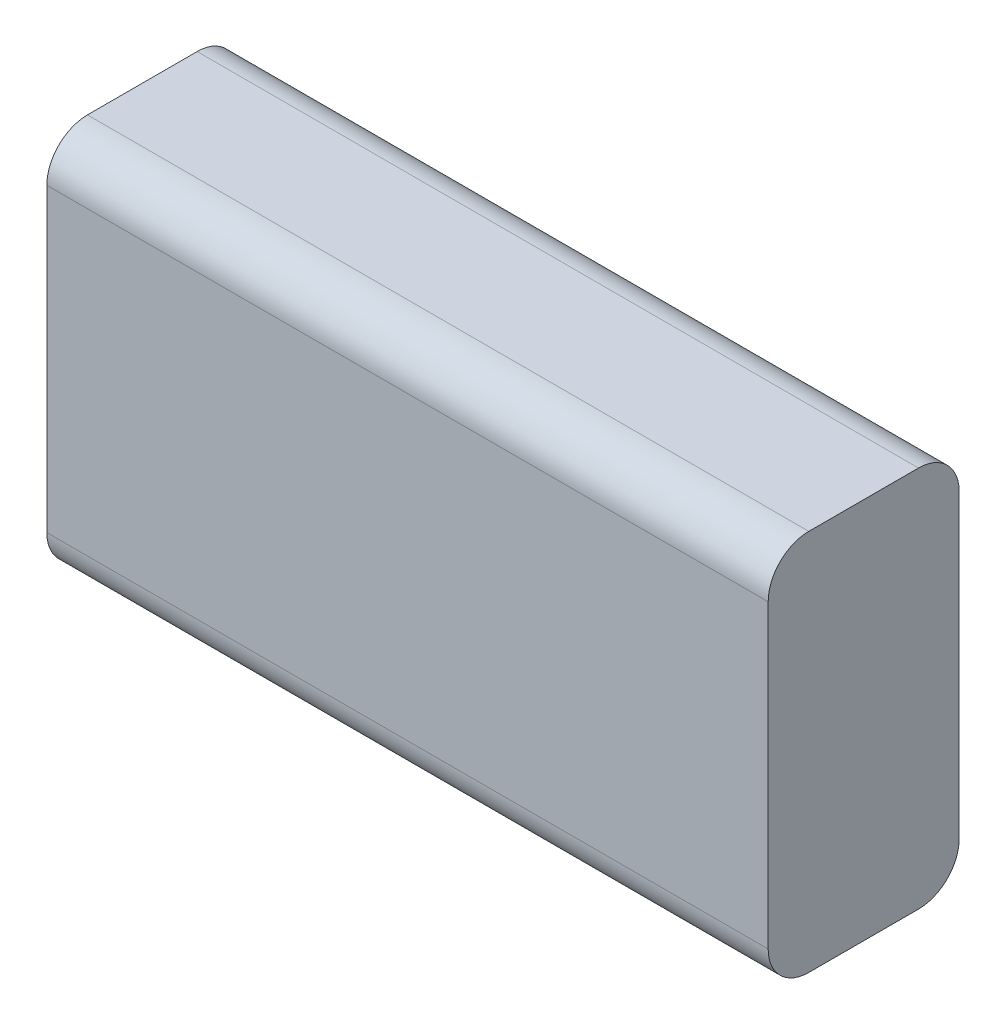
from build123d import *

# Parameters (mm, degrees)
ESQUISSE1_W      = 71
ESQUISSE1_H      = 37.6
EXTRUSION1_DEPTH = 18.8
CONG_1_R         = 4
CONG_2_R         = 4
CONG_3_R         = 4


with BuildPart() as part:
    # Esquisse1 → Extrusion1 (new body)
    with BuildSketch(Plane.XY):
        with Locations((-7.553014699, -1.477523911)):
            Rectangle(ESQUISSE1_W, ESQUISSE1_H)
    extrude(amount=EXTRUSION1_DEPTH)

    # Congé1
    cong_1_edges = [part.edges().sort_by_distance(p)[0] for p in [
        (-7.553014699, 17.322476089, 18.8),
    ]]
    fillet(cong_1_edges, radius=CONG_1_R)

    # Congé2
    cong_2_edges = [part.edges().sort_by_distance(p)[0] for p in [
        (-7.553014699, -20.277523911, 18.8),
        (-7.553014699, 17.322476089, 0),
    ]]
    fillet(cong_2_edges, radius=CONG_2_R)

    # Congé3
    cong_3_edges = [part.edges().sort_by_distance(p)[0] for p in [
        (-7.553014699, -20.277523911, 0),
    ]]
    fillet(cong_3_edges, radius=CONG_3_R)


solid = part.part
